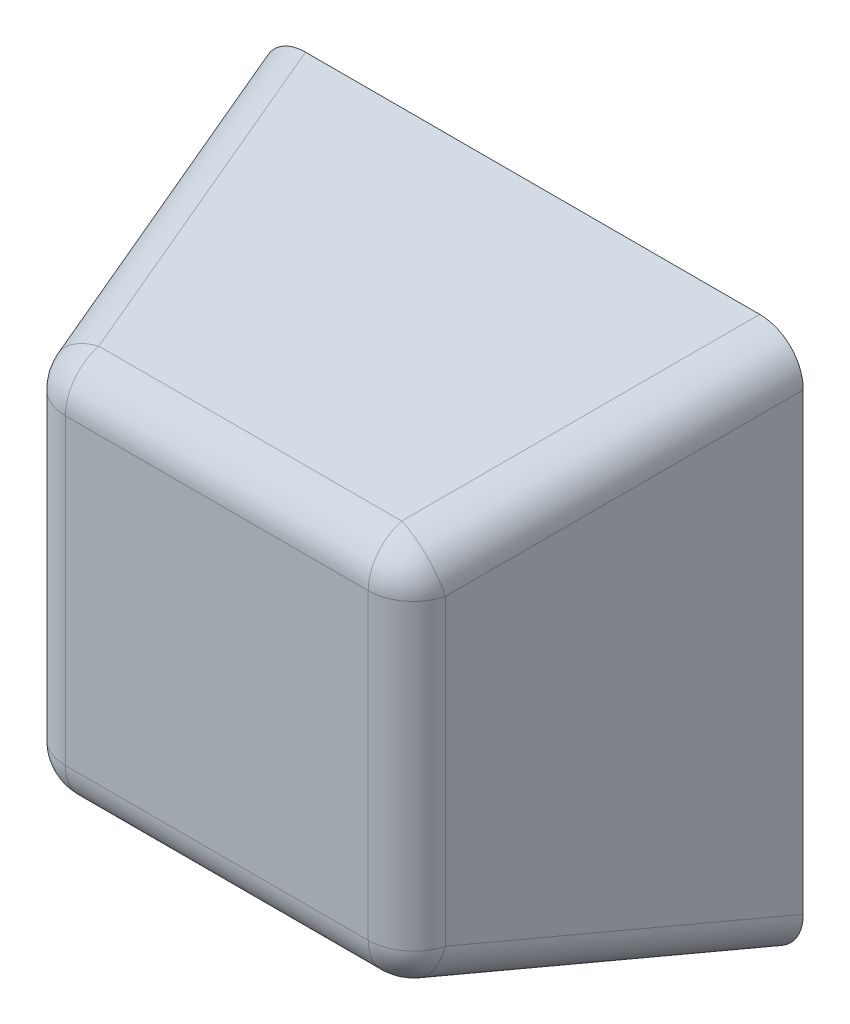
from build123d import *

# Parameters (mm, degrees)
SKETCH1_W           = 12
SKETCH1_H           = 12
BOSS_EXTRUDE1_DEPTH = 7
BOSS_EXTRUDE1_TAPER = 15
FILLET1_R           = 1


with BuildPart() as part:
    # Sketch1 → Boss-Extrude1 (new body)
    with BuildSketch(Plane.XY):
        with Locations((6, 6)):
            Rectangle(SKETCH1_W, SKETCH1_H)
    extrude(amount=BOSS_EXTRUDE1_DEPTH, taper=BOSS_EXTRUDE1_TAPER)

    # Fillet1
    fillet1_edges = [part.edges().sort_by_distance(p)[0] for p in [
        (10.124355653, 6, 7),
        (6, 10.124355653, 7),
        (1.875644347, 6, 7),
        (6, 1.875644347, 7),
        (0.937822174, 11.062177826, 3.5),
        (11.062177826, 11.062177826, 3.5),
        (11.062177826, 0.937822174, 3.5),
        (0.937822174, 0.937822174, 3.5),
    ]]
    fillet(fillet1_edges, radius=FILLET1_R)


solid = part.part
